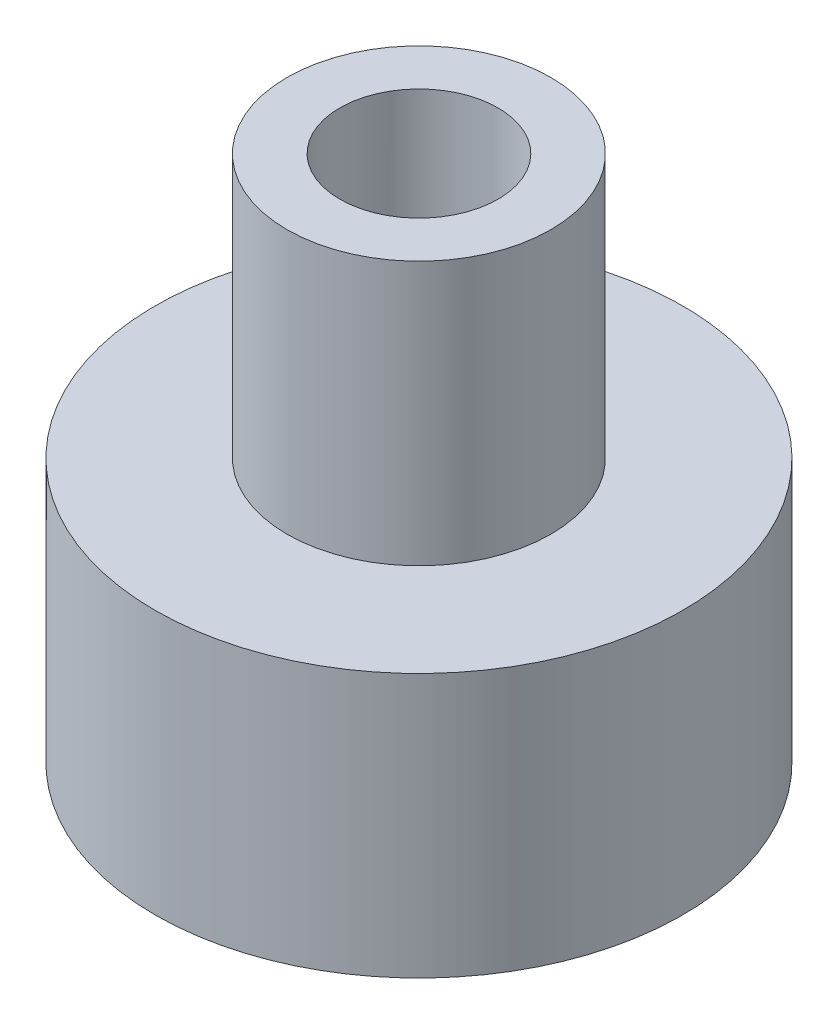
from build123d import *

# Parameters (mm, degrees)
ESQUISSE1_R             = 5
BOSS_EXTRU_1_DEPTH      = 5
ESQUISSE2_R             = 2.5
BOSS_EXTRU_2_DEPTH      = 5
ESQUISSE3_R             = 1.5
ENL_V_MAT_EXTRU_2_DEPTH = 5
ESQUISSE4_R             = 2.05
ENL_V_MAT_EXTRU_3_DEPTH = 5


with BuildPart() as part:
    # Esquisse1 → Boss.-Extru.1 (new body)
    with BuildSketch(Plane(origin=(0, 0, 0), x_dir=(1, 0, 0), z_dir=(0, 1, 0))):
        with Locations(Location((0, 0, 0), (0, 0, 270))):
            Circle(ESQUISSE1_R)
    extrude(amount=BOSS_EXTRU_1_DEPTH)

    # Esquisse2 → Boss.-Extru.2 (add)
    with BuildSketch(Plane(origin=(0, 5, 0), x_dir=(1, 0, 0), z_dir=(0, 1, 0))):
        with Locations(Location((0, 0, 0), (0, 0, 270))):
            Circle(ESQUISSE2_R)
    extrude(amount=BOSS_EXTRU_2_DEPTH)

    # Esquisse3 → Enlèv. mat.-Extru.2 (cut)
    with BuildSketch(Plane(origin=(0, 10, 0), x_dir=(1, 0, 0), z_dir=(0, 1, 0))):
        with Locations(Location((0, 0, 0), (0, 0, 270))):
            Circle(ESQUISSE3_R)
    extrude(amount=-ENL_V_MAT_EXTRU_2_DEPTH, mode=Mode.SUBTRACT)

    # Esquisse4 → Enlèv. mat.-Extru.3 (cut)
    with BuildSketch(Plane.XZ):
        with Locations(Location((0, 0, 0), (0, 0, 270))):
            Circle(ESQUISSE4_R)
    extrude(amount=-ENL_V_MAT_EXTRU_3_DEPTH, mode=Mode.SUBTRACT)


solid = part.part
